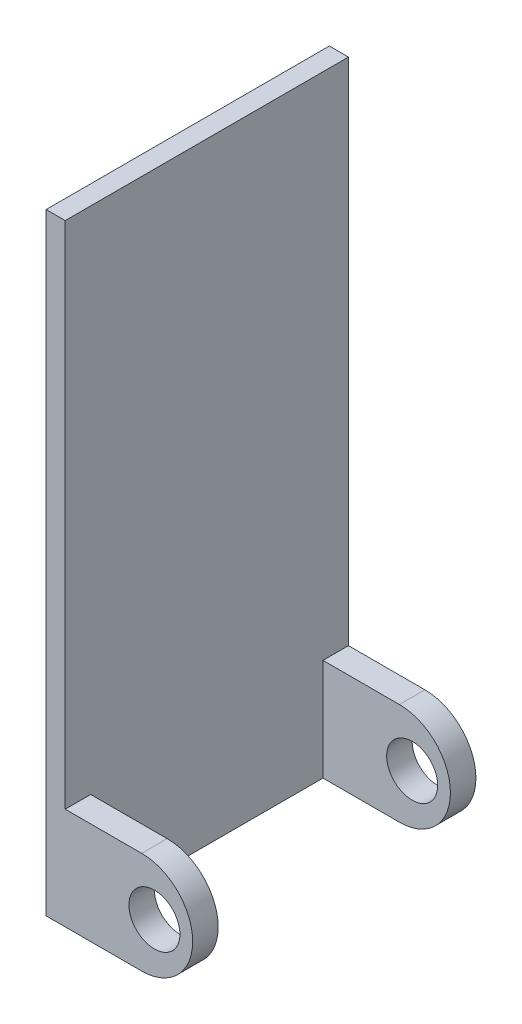
from build123d import *

# Parameters (mm, degrees)
SKETCH1_W                   = 3
SKETCH1_H                   = 96
BOSS_EXTRUDE1_DEPTH         = 44.45
SKETCH2_W                   = 20
SKETCH2_H                   = 16
SKETCH2_R                   = 4
BOSS_EXTRUDE2_DEPTH         = 4
FILLET2_RADIUS              = 8
FILLET2_LENGTH              = 4
FILLET2_OF_MIRROR2_2_RADIUS = 8
FILLET2_OF_MIRROR2_2_LENGTH = 4


with BuildPart() as part:
    # Sketch1 → Boss-Extrude1 (new body)
    with BuildSketch(Plane.XY):
        Rectangle(SKETCH1_W, SKETCH1_H)
    extrude(amount=BOSS_EXTRUDE1_DEPTH)

    # Sketch2 → Boss-Extrude2 (add)
    with BuildSketch(Plane.XY.offset(44.45)):
        with Locations((11.5, -40)):
            Rectangle(SKETCH2_W, SKETCH2_H)
        with Locations((15.5, -40)):
            Circle(SKETCH2_R, mode=Mode.SUBTRACT)
    boss_extrude2 = extrude(amount=-BOSS_EXTRUDE2_DEPTH)

    # Fillet2: full round fillet: the end face becomes a half cylinder, R = half its width
    fillet2_face = Plane((21.5, -40, 42.45), x_dir=(0, 0, -1), z_dir=(1, 0, 0))  # on the end face: x along it, z out of the body
    fillet2_slab = fillet2_face.offset(-FILLET2_RADIUS / 2) * Box(FILLET2_LENGTH, 2 * FILLET2_RADIUS, FILLET2_RADIUS, mode=Mode.PRIVATE)  # the body's end, R deep
    fillet2_round = Plane((13.5, -40, 42.45), x_dir=(1, 0, 0), z_dir=(0, 0, -1)) * Cylinder(FILLET2_RADIUS, FILLET2_LENGTH, mode=Mode.PRIVATE)  # its axis R under the face
    add(fillet2_slab - fillet2_round, mode=Mode.SUBTRACT)

    # Mirror2: Boss-Extrude2 across plane
    add(boss_extrude2.mirror(Plane.XY.offset(22.225)))

    # Fillet2 of Mirror2 2: full round fillet: the end face becomes a half cylinder, R = half its width
    fillet2_of_mirror2_2_face = Plane((21.5, -40, 2), x_dir=(0, 0, 1), z_dir=(1, 0, 0))  # on the end face: x along it, z out of the body
    fillet2_of_mirror2_2_slab = fillet2_of_mirror2_2_face.offset(-FILLET2_OF_MIRROR2_2_RADIUS / 2) * Box(FILLET2_OF_MIRROR2_2_LENGTH, 2 * FILLET2_OF_MIRROR2_2_RADIUS, FILLET2_OF_MIRROR2_2_RADIUS, mode=Mode.PRIVATE)  # the body's end, R deep
    fillet2_of_mirror2_2_round = Plane((13.5, -40, 2), x_dir=(1, 0, 0), z_dir=(0, 0, 1)) * Cylinder(FILLET2_OF_MIRROR2_2_RADIUS, FILLET2_OF_MIRROR2_2_LENGTH, mode=Mode.PRIVATE)  # its axis R under the face
    add(fillet2_of_mirror2_2_slab - fillet2_of_mirror2_2_round, mode=Mode.SUBTRACT)


solid = part.part
